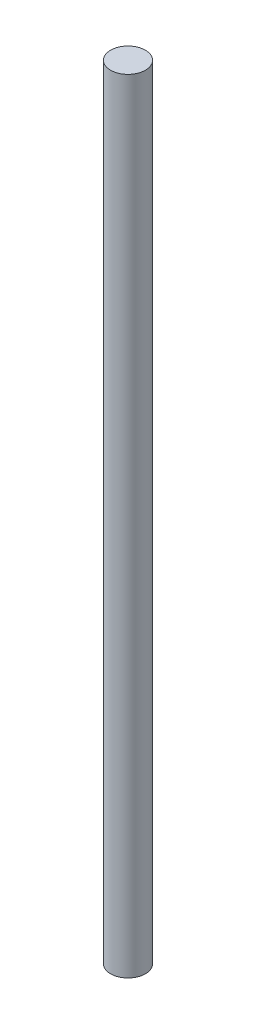
from build123d import *

# Parameters (mm, degrees)
SKETCH1_R           = 3
BOSS_EXTRUDE1_DEPTH = 67.5


with BuildPart() as part:
    # Sketch1 → Boss-Extrude1 (new, symmetric)
    with BuildSketch(Plane(origin=(0, 0, 0), x_dir=(1, 0, 0), z_dir=(0, 1, 0))):
        with Locations(Location((0, 0, 0), (0, 0, 270))):
            Circle(SKETCH1_R)
    extrude(amount=BOSS_EXTRUDE1_DEPTH, both=True)


solid = part.part
